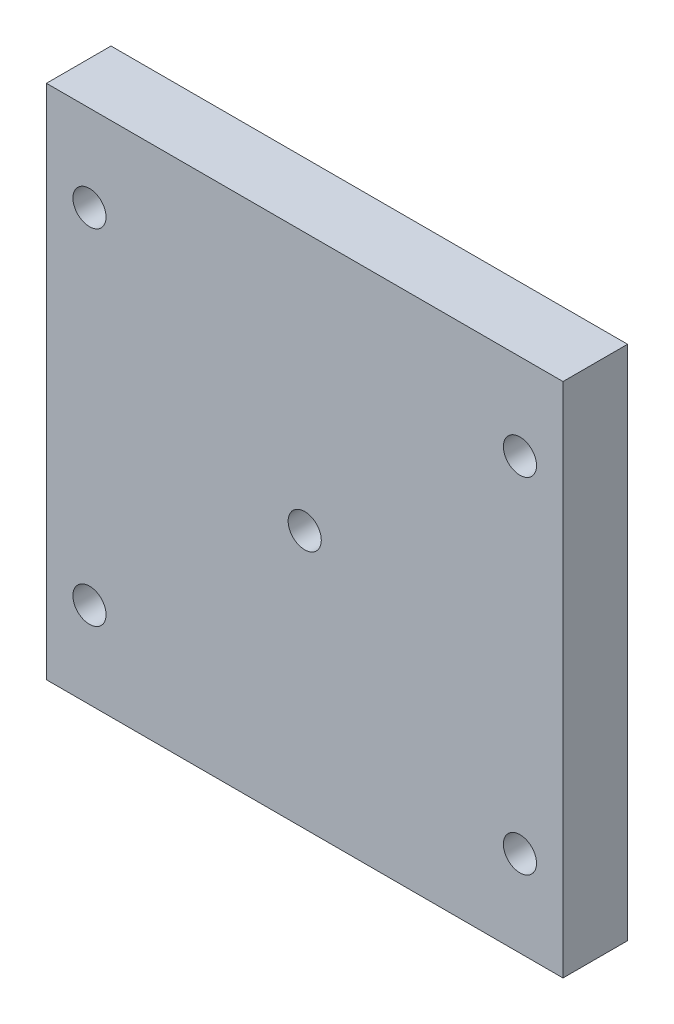
from build123d import *

# Parameters (mm, degrees)
SKETCH1_W                = 304.8
SKETCH1_H                = 304.8
BOSS_EXTRUDE1_DEPTH      = 38.1
SKETCH2_R                = 6.5151
HAAS_T_SLOT_HOLES_DEPTH  = 219.867836833
SKETCH3_R                = 9.779
HAAS_COUNTER_BORES_DEPTH = 22.225


with BuildPart() as part:
    # Sketch1 → Boss-Extrude1 (new body)
    with BuildSketch(Plane.XY):
        Rectangle(SKETCH1_W, SKETCH1_H)
    extrude(amount=BOSS_EXTRUDE1_DEPTH)

    # Sketch2 → HAAS T-Slot Holes (cut, through all)
    with BuildSketch(Plane.XY.offset(38.1)):
        with Locations((-127, 101.6)):
            Circle(SKETCH2_R)
        with Locations((127, 101.6)):
            Circle(SKETCH2_R)
        with Locations((127, -101.6)):
            Circle(SKETCH2_R)
        with Locations((-127, -101.6)):
            Circle(SKETCH2_R)
        Circle(SKETCH2_R)
    extrude(amount=-HAAS_T_SLOT_HOLES_DEPTH, mode=Mode.SUBTRACT)

    # Sketch3 → HAAS Counter Bores (cut)
    with BuildSketch(Plane.XY.offset(38.1)):
        with Locations((-127, 101.6)):
            Circle(SKETCH3_R)
        with Locations((127, 101.6)):
            Circle(SKETCH3_R)
        Circle(SKETCH3_R)
        with Locations((127, -101.6)):
            Circle(SKETCH3_R)
        with Locations((-127, -101.6)):
            Circle(SKETCH3_R)
    extrude(amount=-HAAS_COUNTER_BORES_DEPTH, mode=Mode.SUBTRACT)


solid = part.part
